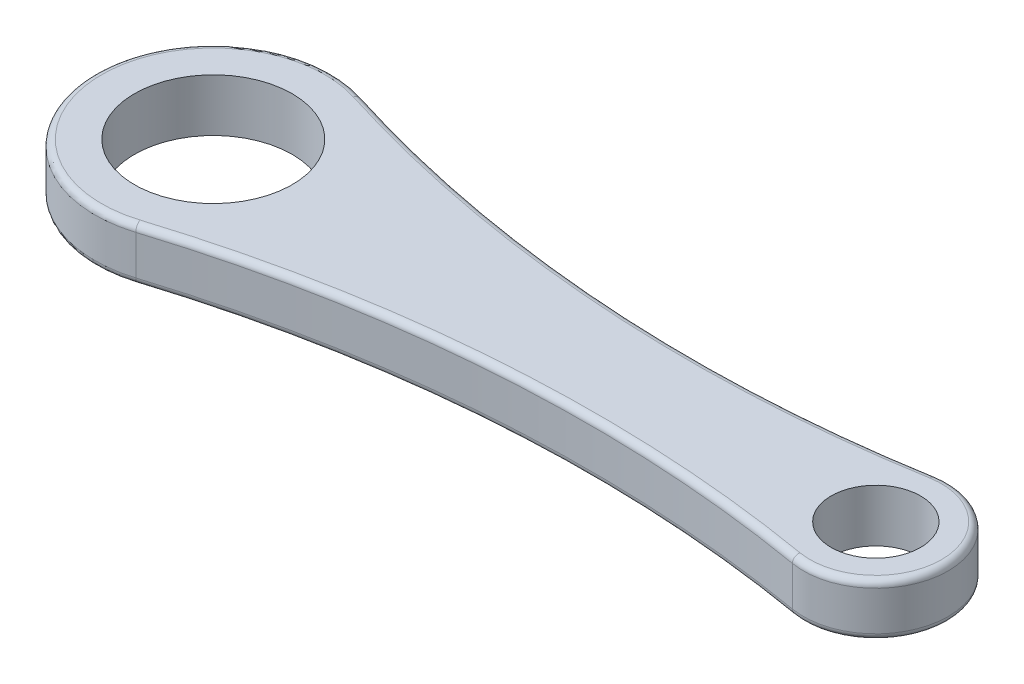
from build123d import *

# Parameters (mm, degrees)
SKETCH_1_R      = 6
SKETCH_1_R_2    = 3.4
EXTRUDE_1_DEPTH = 4
FILLET_1_R      = 0.5


with BuildPart() as part:
    # 草图1 → 凸台-拉伸1 (new body)
    with BuildSketch(Plane(origin=(0, 0, 0), x_dir=(1, 0, 0), z_dir=(0, 1, 0))):
        with BuildLine():
            ThreePointArc((2.692622508, 8.587769444), (-9, 0), (2.692622508, -8.587769444))
            ThreePointArc((2.692622508, -8.587769444), (25.896711744, -4.228545419), (49.476543086, -5.421921))
            ThreePointArc((49.476543086, -5.421921), (55.9, 0), (49.476543086, 5.421921))
            ThreePointArc((49.476543086, 5.421921), (25.896711744, 4.228545419), (2.692622508, 8.587769444))
        make_face()
        with Locations(Location((0, 0, 0), (0, 0, 270))):
            Circle(SKETCH_1_R, mode=Mode.SUBTRACT)
        with Locations(Location((50.4, 0, 0), (0, 0, 270))):
            Circle(SKETCH_1_R_2, mode=Mode.SUBTRACT)
    extrude(amount=EXTRUDE_1_DEPTH)

    # 圆角1
    fillet_1_edges = [part.edges().sort_by_distance(p)[0] for p in [
        (25.896711744, 4, 4.228545419),
        (55.9, 4, 0),
        (25.896711744, 4, -4.228545419),
        (55.9, 0, 0),
        (25.896711744, 0, 4.228545419),
        (-9, 0, 0),
        (25.896711744, 0, -4.228545419),
        (-9, 4, 0),
    ]]
    fillet(fillet_1_edges, radius=FILLET_1_R)


solid = part.part
